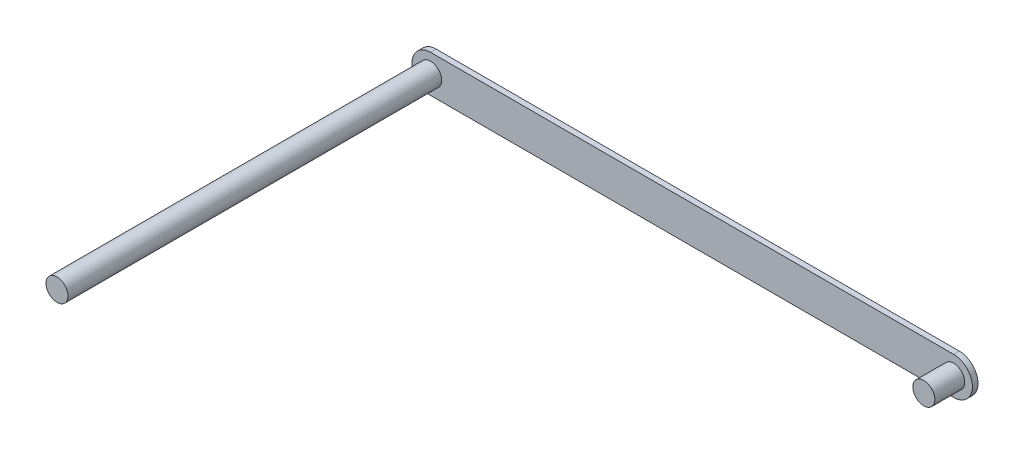
from build123d import *

# Parameters (mm, degrees)
BOSS_EXTRUDE1_DEPTH = 1.5
SKETCH2_R           = 2.95
BOSS_EXTRUDE2_DEPTH = 8
SKETCH3_R           = 2.95
BOSS_EXTRUDE3_DEPTH = 92


with BuildPart() as part:
    # Sketch1 → Boss-Extrude1 (new body)
    with BuildSketch(Plane.XY):
        with BuildLine():
            Line((0, 5), (140, 5))
            ThreePointArc((140, 5), (145, 0), (140, -5))
            Line((140, -5), (0, -5))
            ThreePointArc((0, -5), (-5, 0), (0, 5))
        make_face()
    extrude(amount=BOSS_EXTRUDE1_DEPTH)

    # Sketch2 → Boss-Extrude2 (add)
    with BuildSketch(Plane.XY.offset(1.5)):
        Circle(SKETCH2_R)
        with Locations((140, 0)):
            Circle(SKETCH2_R)
    extrude(amount=BOSS_EXTRUDE2_DEPTH)

    # Sketch3 → Boss-Extrude3 (add)
    with BuildSketch(Plane.XY.offset(9.5)):
        Circle(SKETCH3_R)
    extrude(amount=BOSS_EXTRUDE3_DEPTH)


solid = part.part
